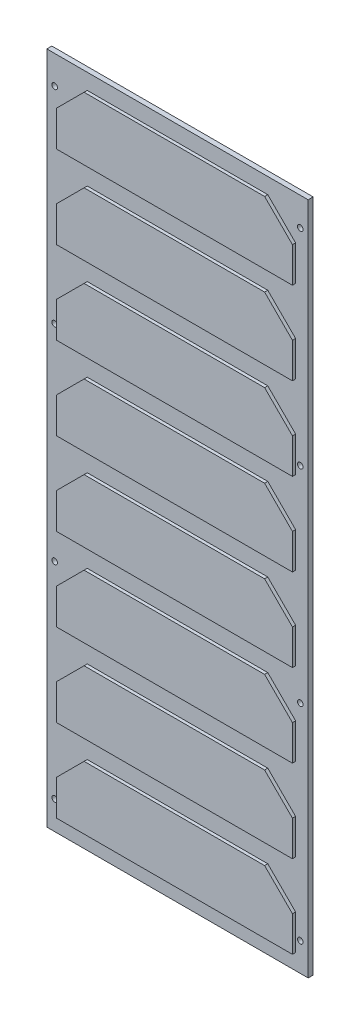
from build123d import *

# Parameters (mm, degrees)
SKETCH1_W                 = 83
SKETCH1_H                 = 214
BOSS_EXTRUDE1_DEPTH       = 1.5875
BOSS_EXTRUDE2_DEPTH       = 1
F_0_CLEARANCE_HOLE1_D     = 1.778
F_0_CLEARANCE_HOLE1_DEPTH = 3.175
F_0_CLEARANCE_HOLE1_TIP   = 0.53416509


with BuildPart() as part:
    # Sketch1 → Boss-Extrude1 (new body)
    with BuildSketch(Plane.XY):
        Rectangle(SKETCH1_W, SKETCH1_H)
    extrude(amount=BOSS_EXTRUDE1_DEPTH)

    # Sketch2 → Boss-Extrude2 (add)
    with BuildSketch(Plane.XY.offset(1.5875)):
        Polygon((-28.661165235, 102), (28.661165235, 102), (37.5, 93.161165235), (37.5, 82), (-37.5, 82), (-37.5, 93.161165235), align=None)
        Polygon((-28.661165235, 75.714285714), (28.661165235, 75.714285714), (37.5, 66.875450949), (37.5, 55.714285714), (-37.5, 55.714285714), (-37.5, 66.875450949), align=None)
        Polygon((-28.661165235, 49.428571429), (28.661165235, 49.428571429), (37.5, 40.589736664), (37.5, 29.428571429), (-37.5, 29.428571429), (-37.5, 40.589736664), align=None)
        Polygon((-28.661165235, 23.142857143), (28.661165235, 23.142857143), (37.5, 14.304022378), (37.5, 3.142857143), (-37.5, 3.142857143), (-37.5, 14.304022378), align=None)
        Polygon((-28.661165235, -3.142857143), (28.661165235, -3.142857143), (37.5, -11.981691908), (37.5, -23.142857143), (-37.5, -23.142857143), (-37.5, -11.981691908), align=None)
        Polygon((-28.661165235, -29.428571429), (28.661165235, -29.428571429), (37.5, -38.267406193), (37.5, -49.428571429), (-37.5, -49.428571429), (-37.5, -38.267406193), align=None)
        Polygon((-28.661165235, -55.714285714), (28.661165235, -55.714285714), (37.5, -64.553120479), (37.5, -75.714285714), (-37.5, -75.714285714), (-37.5, -64.553120479), align=None)
        Polygon((-28.661165235, -82), (28.661165235, -82), (37.5, -90.838834765), (37.5, -102), (-37.5, -102), (-37.5, -90.838834765), align=None)
    extrude(amount=BOSS_EXTRUDE2_DEPTH)

    # #0 Clearance Hole1
    with Locations(Plane.XY.offset(1.5875)):
        with Locations((-39, 98), (39, 98), (39, 32.666666667), (39, -32.666666667), (39, -98), (-39, -98), (-39, -32.666666667), (-39, 32.666666667)):
            Hole(F_0_CLEARANCE_HOLE1_D / 2, depth=F_0_CLEARANCE_HOLE1_DEPTH)
            with Locations((0, 0, -(F_0_CLEARANCE_HOLE1_DEPTH + F_0_CLEARANCE_HOLE1_TIP / 2))):  # 118° drill point
                Cone(0, F_0_CLEARANCE_HOLE1_D / 2, F_0_CLEARANCE_HOLE1_TIP, mode=Mode.SUBTRACT)


solid = part.part
